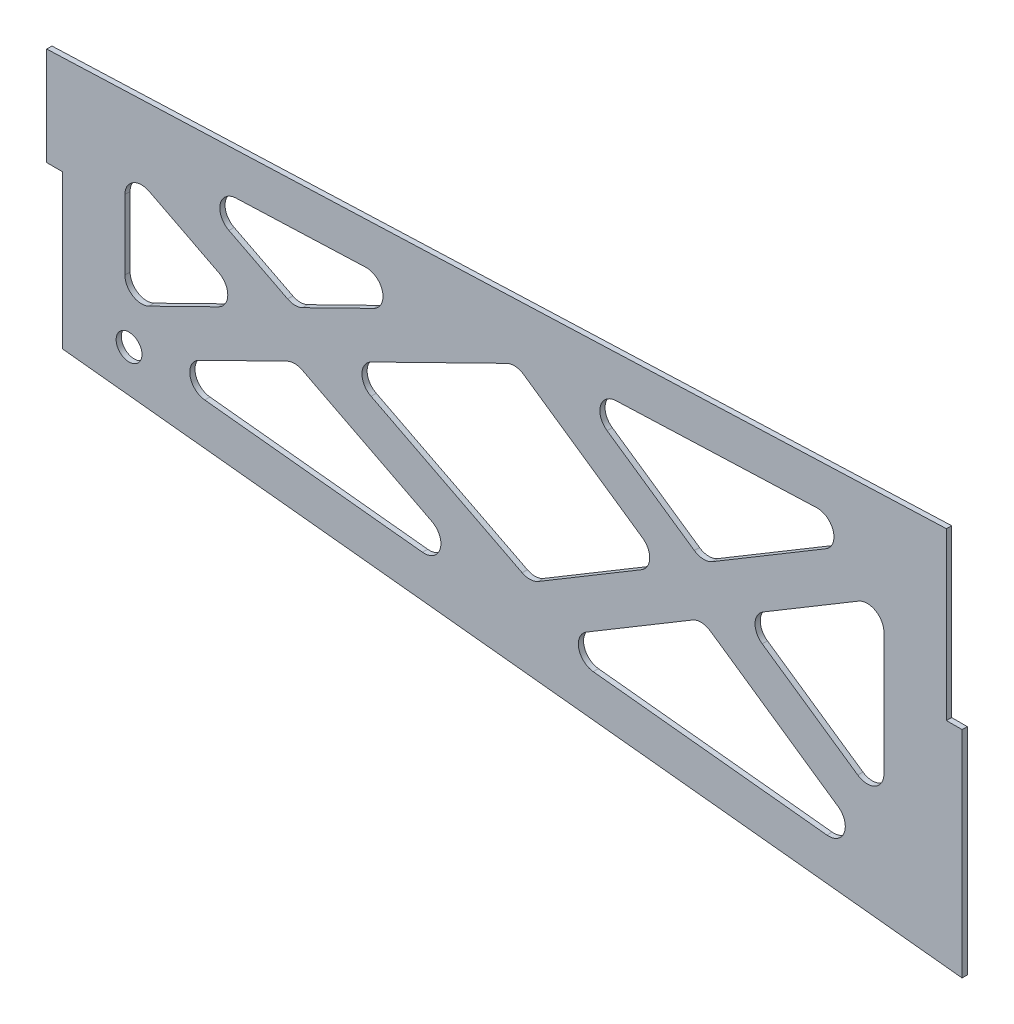
from build123d import *

# Parameters (mm, degrees)
BOSS_EXTRUDE1_DEPTH = 1.5875
CUT_EXTRUDE1_DEPTH  = 303.12680487
CUT_EXTRUDE2_DEPTH  = 1.5875
FILLET1_R           = 5.08
SKETCH4_R           = 3.937
CUT_EXTRUDE3_DEPTH  = 303.056645934


with BuildPart() as part:
    # Sketch1 → Boss-Extrude1 (new body)
    with BuildSketch(Plane.XY):
        Polygon((-274.065317552, 28.949090055), (0, 0), (0, 116.332), (-278.827817552, 105.657090055), (-278.827817552, 88.385090055), (-278.827817552, 75.685090055), (-274.065317552, 75.685090055), align=None)
    extrude(amount=BOSS_EXTRUDE1_DEPTH)

    # Sketch2 → Cut-Extrude1 (cut, through all)
    with BuildSketch(Plane.XY.offset(1.5875)):
        Polygon((0, 116.332), (0, 65.532), (-4.7625, 65.532), (-4.7625, 116.14966791), align=None)
        Polygon((0, -5.469950558), (-4.7625, -5.469950558), (-4.7625, 0.503055413), (0, 0), align=None)
    extrude(amount=-CUT_EXTRUDE1_DEPTH, mode=Mode.SUBTRACT)

    # Sketch3 → Cut-Extrude2 (cut)
    with BuildSketch(Plane.XY.offset(1.5875)):
        Polygon((-240.657781537, 94.409124071), (-157.755224497, 97.583044587), (-203.185900054, 75.261166333), align=None)
        Polygon((-255.015317552, 87.483730445), (-255.015317552, 49.79533442), (-217.414707933, 68.269993226), align=None)
        Polygon((-248.210308368, 38.988718693), (-203.29748305, 61.056156751), (-137.156149504, 27.258241905), align=None)
        Polygon((-189.068675171, 68.047329858), (-136.005712706, 94.119250944), (-90.836715855, 62.962907236), (-131.496140727, 38.628031633), align=None)
        Polygon((-120.716079793, 99.001086509), (-24.466190753, 102.686009006), (-78.860877706, 70.130508168), align=None)
        Polygon((-127.472455762, 26.235368508), (-79.347844483, 55.0381967), (-21.337942125, 15.024546137), align=None)
        Polygon((-67.372006334, 62.205797632), (-23.8125, 88.276386956), (-23.8125, 32.159636644), align=None)
    extrude(amount=-CUT_EXTRUDE2_DEPTH, mode=Mode.SUBTRACT)

    # Fillet1
    fillet1_edges = [part.edges().sort_by_distance(p)[0] for p in [
        (-255.015317552, 87.483730445, 0.79375),
        (-217.414707933, 68.269993226, 0.79375),
        (-255.015317552, 49.79533442, 0.79375),
        (-127.472455762, 26.235368508, 0.79375),
        (-21.337942125, 15.024546137, 0.79375),
        (-79.347844483, 55.0381967, 0.79375),
        (-248.210308368, 38.988718693, 0.79375),
        (-137.156149504, 27.258241905, 0.79375),
        (-203.29748305, 61.056156751, 0.79375),
        (-240.657781537, 94.409124071, 0.79375),
        (-203.185900054, 75.261166333, 0.79375),
        (-157.755224497, 97.583044587, 0.79375),
        (-136.005712706, 94.119250944, 0.79375),
        (-189.068675171, 68.047329858, 0.79375),
        (-131.496140727, 38.628031633, 0.79375),
        (-90.836715855, 62.962907236, 0.79375),
        (-67.372006334, 62.205797632, 0.79375),
        (-23.8125, 32.159636644, 0.79375),
        (-23.8125, 88.276386956, 0.79375),
        (-24.466190753, 102.686009006, 0.79375),
        (-120.716079793, 99.001086509, 0.79375),
        (-78.860877706, 70.130508168, 0.79375),
    ]]
    fillet(fillet1_edges, radius=FILLET1_R)

    # Sketch4 → Cut-Extrude3 (cut, through all)
    with BuildSketch(Plane.XY.offset(1.5875)):
        with Locations((-253.745317552, 39.57337304)):
            Circle(SKETCH4_R)
    extrude(amount=-CUT_EXTRUDE3_DEPTH, mode=Mode.SUBTRACT)


solid = part.part
